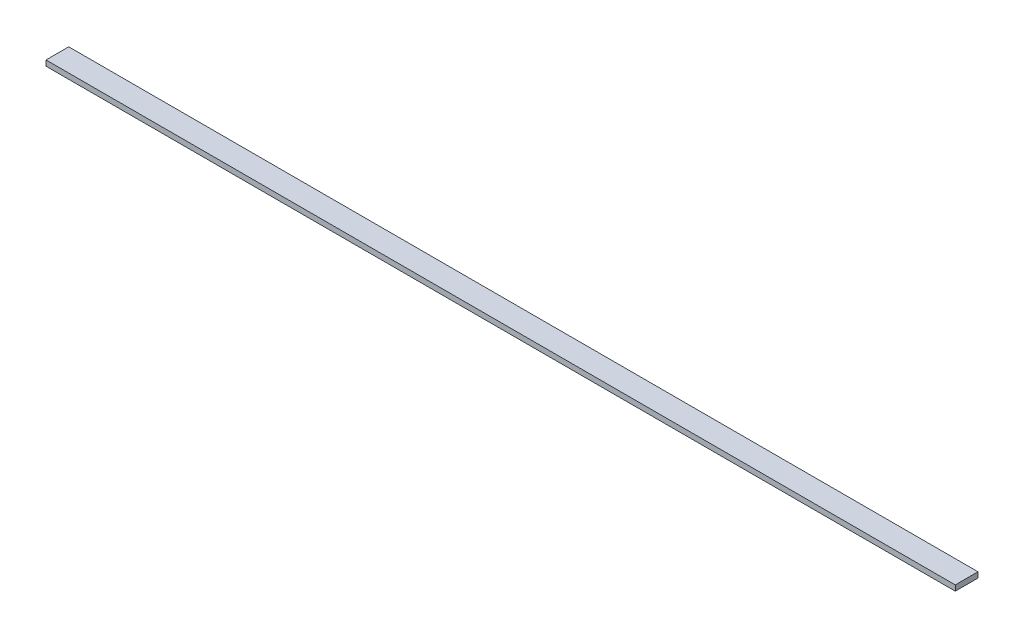
from build123d import *

# Parameters (mm, degrees)
SKETCH1_W           = 1000
SKETCH1_H           = 25
BOSS_EXTRUDE1_DEPTH = 6


with BuildPart() as part:
    # Sketch1 → Boss-Extrude1 (new body)
    with BuildSketch(Plane(origin=(0, 0, 0), x_dir=(1, 0, 0), z_dir=(0, 1, 0))):
        with Locations((424.056699214, 19.163207279)):
            Rectangle(SKETCH1_W, SKETCH1_H)
    extrude(amount=BOSS_EXTRUDE1_DEPTH)


solid = part.part
